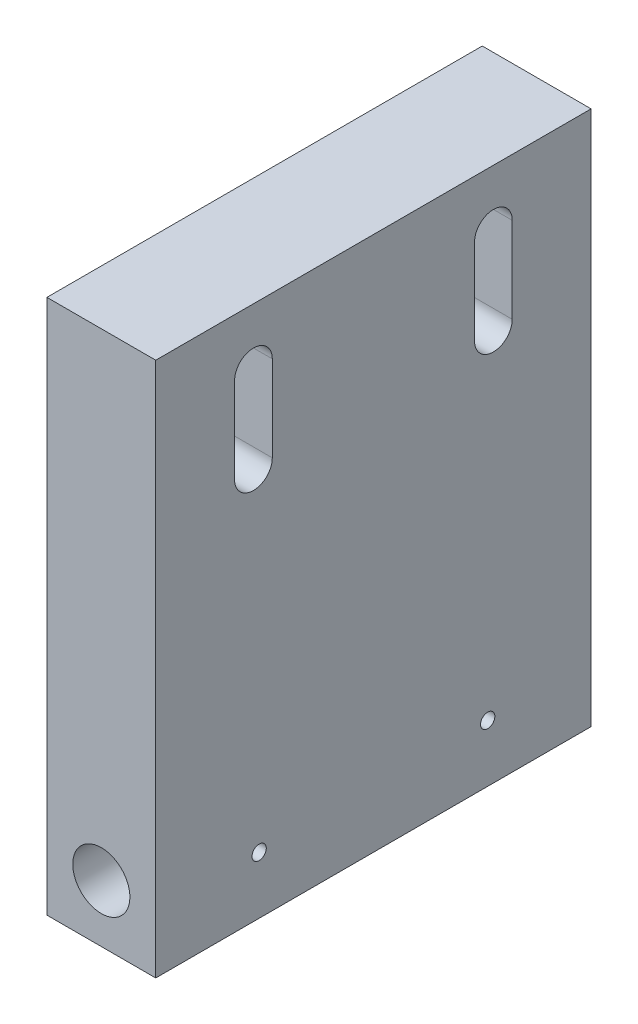
from build123d import *

# Parameters (mm, degrees)
CROQUIS11_W                       = 76.2
CROQUIS11_H                       = 19.05
AL_SOLID_PROFILES_3_X_0_5_1_DEPTH = 93.65
CORTAR_EXTRUIR1_DEPTH             = 103.882627299
DI_METRO_DE_TALADRO_10_0_10_1_D   = 10
TALADRO_ROSCADO_M31_REACH         = 104.883
TALADRO_ROSCADO_M31_BORE_R        = 1.25


with BuildPart() as part:
    # Croquis11 → Al solid profiles 3 X 0.5(1) (new body)
    with BuildSketch(Plane(origin=(0, 93.65, 0), x_dir=(0, 0, 1), z_dir=(0, -1, 0))):
        Rectangle(CROQUIS11_W, CROQUIS11_H)
    extrude(amount=AL_SOLID_PROFILES_3_X_0_5_1_DEPTH)

    # Croquis12 → Cortar-Extruir1 (cut, through all)
    with BuildSketch(Plane(origin=(9.525, 0, 0), x_dir=(0, 0, -1), z_dir=(1, 0, 0))):
        with BuildLine():
            Line((-17.7, 83.65), (-17.7, 68.65))
            ThreePointArc((-17.7, 68.65), (-21, 65.35), (-24.3, 68.65))
            Line((-24.3, 68.65), (-24.3, 83.65))
            ThreePointArc((-24.3, 83.65), (-21, 86.95), (-17.7, 83.65))
        make_face()
        with BuildLine():
            Line((17.7, 83.65), (17.7, 68.65))
            ThreePointArc((17.7, 68.65), (21, 65.35), (24.3, 68.65))
            Line((24.3, 68.65), (24.3, 83.65))
            ThreePointArc((24.3, 83.65), (21, 86.95), (17.7, 83.65))
        make_face()
    extrude(amount=-CORTAR_EXTRUIR1_DEPTH, mode=Mode.SUBTRACT)

    # Diámetro de taladro Ø10.0 (10)1 (through all)
    with Locations(Plane(origin=(0, 0, -38.1), x_dir=(-1, 0, 0), z_dir=(0, 0, -1))):
        with Locations((0, 10)):
            Hole(DI_METRO_DE_TALADRO_10_0_10_1_D / 2)

    # Taladro roscado M31 bore → Taladro roscado M31 (cut, up to next)
    with BuildSketch(Plane(origin=(9.525, 0, 0), x_dir=(0, 0, -1), z_dir=(1, 0, 0)), mode=Mode.PRIVATE) as taladro_roscado_m31_sk1:
        with Locations((20, 10)):
            Circle(TALADRO_ROSCADO_M31_BORE_R)
    taladro_roscado_m31_tool1 = extrude(taladro_roscado_m31_sk1.sketch, amount=-TALADRO_ROSCADO_M31_REACH, mode=Mode.PRIVATE) & part.part
    # Taladro roscado M31 bore → Taladro roscado M31 (cut, up to next)
    with BuildSketch(Plane(origin=(9.525, 0, 0), x_dir=(0, 0, -1), z_dir=(1, 0, 0)), mode=Mode.PRIVATE) as taladro_roscado_m31_sk2:
        with Locations((-20, 10)):
            Circle(TALADRO_ROSCADO_M31_BORE_R)
    taladro_roscado_m31_tool2 = extrude(taladro_roscado_m31_sk2.sketch, amount=-TALADRO_ROSCADO_M31_REACH, mode=Mode.PRIVATE) & part.part
    add(taladro_roscado_m31_tool1.solids().sort_by_distance((9.525, 10, -20))[0], mode=Mode.SUBTRACT)
    add(taladro_roscado_m31_tool2.solids().sort_by_distance((9.525, 10, 20))[0], mode=Mode.SUBTRACT)


solid = part.part
